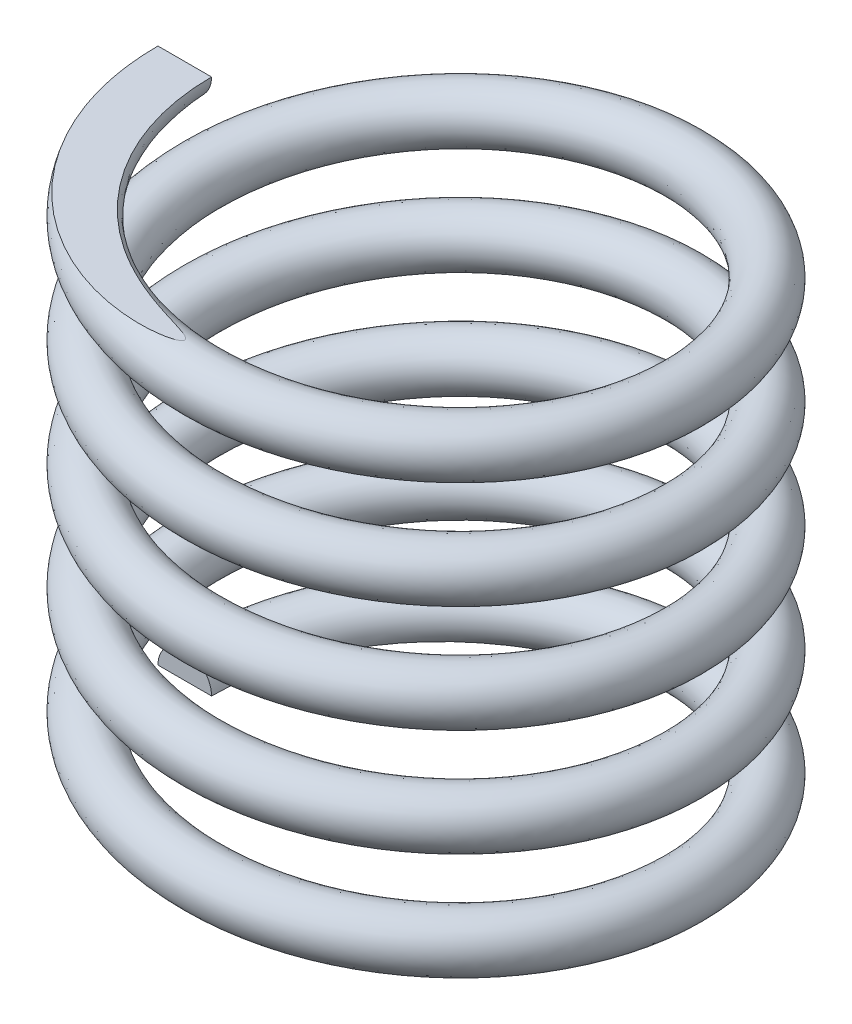
from build123d import *

# Parameters (mm, degrees)
SWEEP1_PITCH            = 4
SWEEP1_HEIGHT           = 20
SWEEP1_RADIUS           = 9
SWEEP1_START_ANGLE      = -90
SKETCH2_R               = 1
CUT_EXTRUDE1_DEPTH      = 26.317979683
CUT_EXTRUDE1_DEPTH_BACK = 26.317979683
SKETCH3_W               = 23.412955559
SKETCH3_H               = 2.156362642
SKETCH3_W_2             = 24.11104827
SKETCH3_H_2             = 2.362775332


with BuildPart() as part:
    # Sweep1: sweep along a helix
    with BuildLine() as sweep1_path:
        add(Helix(SWEEP1_PITCH, SWEEP1_HEIGHT, SWEEP1_RADIUS, center=(0, 0, 0), direction=(0, 1, 0), lefthand=True, mode=Mode.PRIVATE).rotate(Axis((0, 0, 0), (0, 1, 0)), SWEEP1_START_ANGLE))
    # Sketch2 → Sweep1 (sweep)
    with BuildSketch(Plane.XY):
        with Locations((-9, 0)):
            Circle(SKETCH2_R)
    sweep(path=sweep1_path.line, is_frenet=True)

    # Sketch3 → Cut-Extrude1 (cut, two sides: drawn at the far end of the back side and taken through both)
    with BuildSketch(Plane.XY.offset(-CUT_EXTRUDE1_DEPTH_BACK)):
        with Locations((0.644393272, -1.078181321)):
            Rectangle(SKETCH3_W, SKETCH3_H)
        with Locations((0.993439628, 21.181387666)):
            Rectangle(SKETCH3_W_2, SKETCH3_H_2)
    extrude(amount=CUT_EXTRUDE1_DEPTH + CUT_EXTRUDE1_DEPTH_BACK, mode=Mode.SUBTRACT)


solid = part.part
